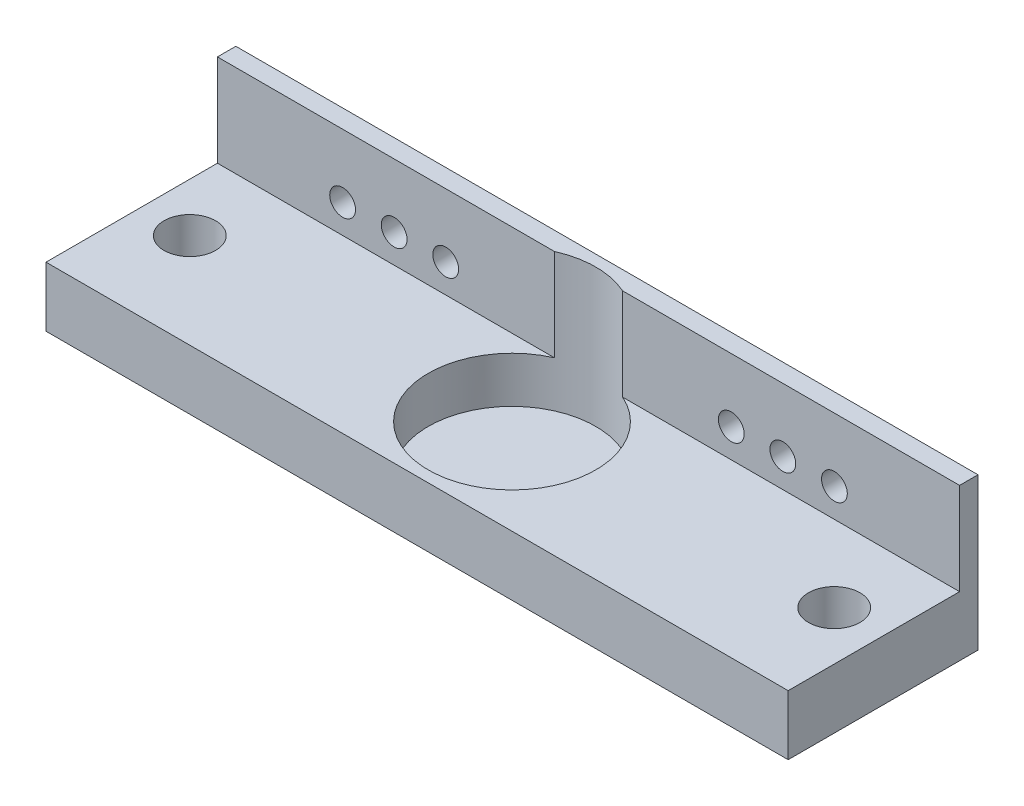
from build123d import *

# Parameters (mm, degrees)
SKETCH1_W           = 102.39
SKETCH1_H           = 26.19
BOSS_EXTRUDE1_DEPTH = 1.905
SKETCH2_W           = 102.39
SKETCH2_H           = 26.19
SKETCH2_R           = 11.557
SKETCH2_R_2         = 3.556
BOSS_EXTRUDE3_DEPTH = 6.35
BOSS_EXTRUDE4_DEPTH = 12.7
CUT_EXTRUDE1_REACH  = 63.204
SKETCH4_R           = 1.778


with BuildPart() as part:
    # Sketch1 → Boss-Extrude1 (new body)
    with BuildSketch(Plane(origin=(0, 0, 0), x_dir=(1, 0, 0), z_dir=(0, 1, 0))):
        Rectangle(SKETCH1_W, SKETCH1_H)
    extrude(amount=BOSS_EXTRUDE1_DEPTH)

    # Sketch2 → Boss-Extrude3 (add)
    with BuildSketch(Plane(origin=(0, 1.905, 0), x_dir=(1, 0, 0), z_dir=(0, 1, 0))):
        Rectangle(SKETCH2_W, SKETCH2_H)
        with Locations(Location((0, 0, 0), (0, 0, 270))):
            Circle(SKETCH2_R, mode=Mode.SUBTRACT)
        with Locations(Location((-44.45, 0, 0), (0, 0, 270))):
            Circle(SKETCH2_R_2, mode=Mode.SUBTRACT)
        with Locations(Location((44.45, 0, 0), (0, 0, 270))):
            Circle(SKETCH2_R_2, mode=Mode.SUBTRACT)
    extrude(amount=BOSS_EXTRUDE3_DEPTH)

    # Sketch3 → Boss-Extrude4 (add)
    with BuildSketch(Plane(origin=(0, 8.255, 0), x_dir=(1, 0, 0), z_dir=(0, 1, 0))):
        with BuildLine():
            Line((-51.195, 13.095), (51.195, 13.095))
            Line((51.195, 13.095), (51.195, 10.555))
            Line((51.195, 10.555), (4.707039834, 10.555))
            ThreePointArc((4.707039834, 10.555), (0, 11.557), (-4.707039834, 10.555))
            Line((-4.707039834, 10.555), (-51.195, 10.555))
            Line((-51.195, 10.555), (-51.195, 13.095))
        make_face()
    extrude(amount=BOSS_EXTRUDE4_DEPTH)

    # Sketch4 → Cut-Extrude1 (cut, up to next)
    with BuildSketch(Plane(origin=(0, 0, -13.095), x_dir=(-1, 0, 0), z_dir=(0, 0, -1)), mode=Mode.PRIVATE) as cut_extrude1_sk1:
        with Locations((33.923, 12.211)):
            Circle(SKETCH4_R)
    cut_extrude1_tool1 = extrude(cut_extrude1_sk1.sketch, amount=-CUT_EXTRUDE1_REACH, mode=Mode.PRIVATE) & part.part
    # Sketch4 → Cut-Extrude1 (cut, up to next)
    with BuildSketch(Plane(origin=(0, 0, -13.095), x_dir=(-1, 0, 0), z_dir=(0, 0, -1)), mode=Mode.PRIVATE) as cut_extrude1_sk2:
        with Locations((26.811, 12.211)):
            Circle(SKETCH4_R)
    cut_extrude1_tool2 = extrude(cut_extrude1_sk2.sketch, amount=-CUT_EXTRUDE1_REACH, mode=Mode.PRIVATE) & part.part
    # Sketch4 → Cut-Extrude1 (cut, up to next)
    with BuildSketch(Plane(origin=(0, 0, -13.095), x_dir=(-1, 0, 0), z_dir=(0, 0, -1)), mode=Mode.PRIVATE) as cut_extrude1_sk3:
        with Locations((19.699, 12.211)):
            Circle(SKETCH4_R)
    cut_extrude1_tool3 = extrude(cut_extrude1_sk3.sketch, amount=-CUT_EXTRUDE1_REACH, mode=Mode.PRIVATE) & part.part
    # Sketch4 → Cut-Extrude1 (cut, up to next)
    with BuildSketch(Plane(origin=(0, 0, -13.095), x_dir=(-1, 0, 0), z_dir=(0, 0, -1)), mode=Mode.PRIVATE) as cut_extrude1_sk4:
        with Locations((-33.923, 12.211)):
            Circle(SKETCH4_R)
    cut_extrude1_tool4 = extrude(cut_extrude1_sk4.sketch, amount=-CUT_EXTRUDE1_REACH, mode=Mode.PRIVATE) & part.part
    # Sketch4 → Cut-Extrude1 (cut, up to next)
    with BuildSketch(Plane(origin=(0, 0, -13.095), x_dir=(-1, 0, 0), z_dir=(0, 0, -1)), mode=Mode.PRIVATE) as cut_extrude1_sk5:
        with Locations((-26.811, 12.211)):
            Circle(SKETCH4_R)
    cut_extrude1_tool5 = extrude(cut_extrude1_sk5.sketch, amount=-CUT_EXTRUDE1_REACH, mode=Mode.PRIVATE) & part.part
    # Sketch4 → Cut-Extrude1 (cut, up to next)
    with BuildSketch(Plane(origin=(0, 0, -13.095), x_dir=(-1, 0, 0), z_dir=(0, 0, -1)), mode=Mode.PRIVATE) as cut_extrude1_sk6:
        with Locations((-19.699, 12.211)):
            Circle(SKETCH4_R)
    cut_extrude1_tool6 = extrude(cut_extrude1_sk6.sketch, amount=-CUT_EXTRUDE1_REACH, mode=Mode.PRIVATE) & part.part
    add(cut_extrude1_tool1.solids().sort_by_distance((-33.923, 12.211, -13.095))[0], mode=Mode.SUBTRACT)
    add(cut_extrude1_tool2.solids().sort_by_distance((-26.811, 12.211, -13.095))[0], mode=Mode.SUBTRACT)
    add(cut_extrude1_tool3.solids().sort_by_distance((-19.699, 12.211, -13.095))[0], mode=Mode.SUBTRACT)
    add(cut_extrude1_tool4.solids().sort_by_distance((33.923, 12.211, -13.095))[0], mode=Mode.SUBTRACT)
    add(cut_extrude1_tool5.solids().sort_by_distance((26.811, 12.211, -13.095))[0], mode=Mode.SUBTRACT)
    add(cut_extrude1_tool6.solids().sort_by_distance((19.699, 12.211, -13.095))[0], mode=Mode.SUBTRACT)


solid = part.part
